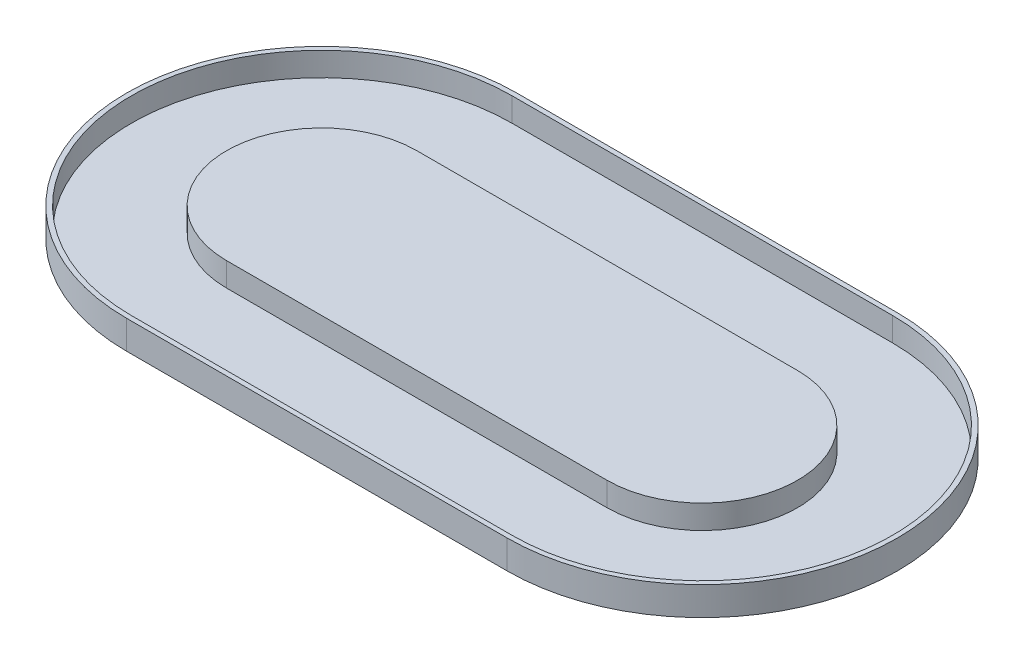
from build123d import *

# Parameters (mm, degrees)
BOSS_EXTRUDE1_DEPTH      = 100
BOSS_EXTRUDE2_DEPTH      = 500
BOSS_EXTRUDE2_DEPTH_BACK = 100
BOSS_EXTRUDE3_DEPTH      = 500
BOSS_EXTRUDE3_DEPTH_BACK = 100


with BuildPart() as part:
    # Sketch1 → Boss-Extrude1 (new body)
    with BuildSketch(Plane(origin=(0, 0, 0), x_dir=(1, 0, 0), z_dir=(0, 1, 0))):
        with BuildLine():
            Line((-4000, -4000), (4000, -4000))
            ThreePointArc((4000, -4000), (8000, 0), (4000, 4000))
            Line((4000, 4000), (-4000, 4000))
            ThreePointArc((-4000, 4000), (-8000, 0), (-4000, -4000))
        make_face()
        with BuildLine():
            Line((-4000, 2000), (4000, 2000))
            ThreePointArc((4000, 2000), (6000, 0), (4000, -2000))
            Line((4000, -2000), (-4000, -2000))
            ThreePointArc((-4000, -2000), (-6000, 0), (-4000, 2000))
        make_face(mode=Mode.SUBTRACT)
    extrude(amount=BOSS_EXTRUDE1_DEPTH)

    # Sketch2 → Boss-Extrude2 (add, two sides: drawn at the far end of the back side and taken through both)
    with BuildSketch(Plane(origin=(0, 100, 0), x_dir=(1, 0, 0), z_dir=(0, 1, 0)).offset(-BOSS_EXTRUDE2_DEPTH_BACK)):
        with BuildLine():
            Line((4000, 4100), (-4000, 4100))
            ThreePointArc((-4000, 4100), (-8100, 0), (-4000, -4100))
            Line((-4000, -4100), (4000, -4100))
            ThreePointArc((4000, -4100), (8100, 0), (4000, 4100))
        make_face()
        with BuildLine():
            Line((-4000, -4000), (4000, -4000))
            ThreePointArc((4000, -4000), (8000, 0), (4000, 4000))
            Line((4000, 4000), (-4000, 4000))
            ThreePointArc((-4000, 4000), (-8000, 0), (-4000, -4000))
        make_face(mode=Mode.SUBTRACT)
    extrude(amount=BOSS_EXTRUDE2_DEPTH + BOSS_EXTRUDE2_DEPTH_BACK)

    # Sketch3 → Boss-Extrude3 (add, two sides: drawn at the far end of the back side and taken through both)
    # profile 1 of 2: a face of its own
    with BuildSketch(Plane(origin=(0, 100, 0), x_dir=(1, 0, 0), z_dir=(0, 1, 0)).offset(-BOSS_EXTRUDE3_DEPTH_BACK)):
        with BuildLine():
            Line((-4000, 2000), (4000, 2000))
            ThreePointArc((4000, 2000), (6000, 0), (4000, -2000))
            Line((4000, -2000), (-4000, -2000))
            ThreePointArc((-4000, -2000), (-6000, 0), (-4000, 2000))
        make_face()
        with BuildLine():
            ThreePointArc((4000, -1900), (5900, 0), (4000, 1900))
            Line((4000, 1900), (-4000, 1900))
            ThreePointArc((-4000, 1900), (-5900, 0), (-4000, -1900))
            Line((-4000, -1900), (4000, -1900))
        make_face(mode=Mode.SUBTRACT)
    # profile 2 of 2: a face of its own
    with BuildSketch(Plane(origin=(0, 100, 0), x_dir=(1, 0, 0), z_dir=(0, 1, 0)).offset(-BOSS_EXTRUDE3_DEPTH_BACK)):
        with BuildLine():
            Line((4000, 2000), (-4000, 2000))
            ThreePointArc((-4000, 2000), (-6000, 0), (-4000, -2000))
            Line((-4000, -2000), (4000, -2000))
            ThreePointArc((4000, -2000), (6000, 0), (4000, 2000))
        make_face()
    extrude(amount=BOSS_EXTRUDE3_DEPTH + BOSS_EXTRUDE3_DEPTH_BACK)


solid = part.part
